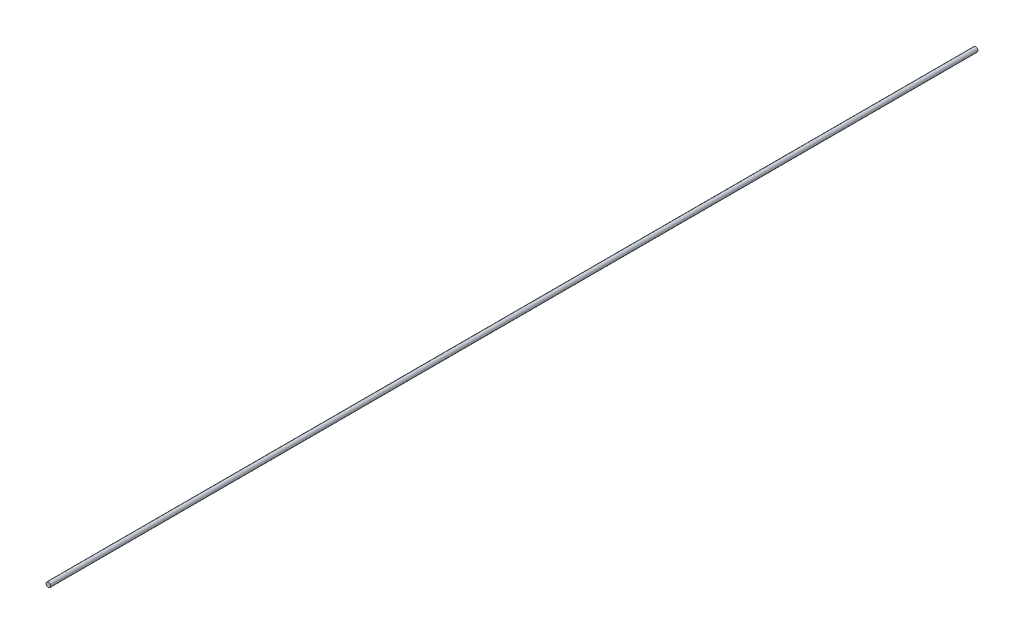
from build123d import *

# Parameters (mm, degrees)
SKETCH1_R           = 3.175
BOSS_EXTRUDE1_DEPTH = 1270


with BuildPart() as part:
    # Sketch1 → Boss-Extrude1 (new body)
    with BuildSketch(Plane.XY):
        with Locations(Location((0, 0, 0), (0, 0, 180))):
            Circle(SKETCH1_R)
    extrude(amount=BOSS_EXTRUDE1_DEPTH)


solid = part.part
